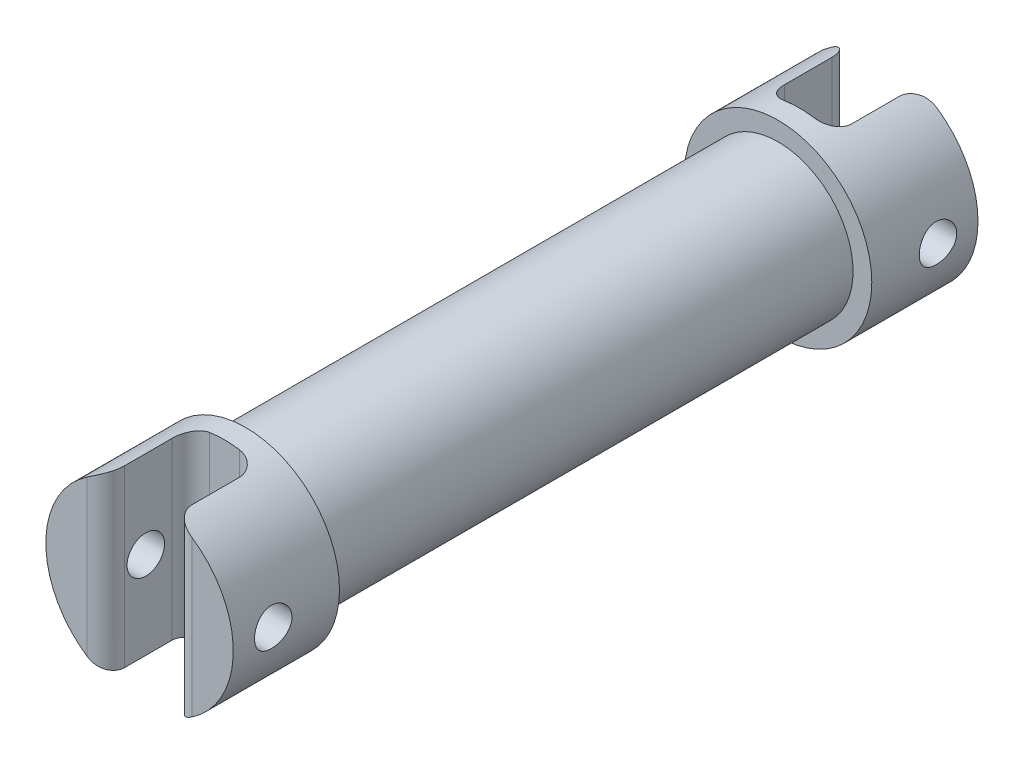
from build123d import *

# Parameters (mm, degrees)
SKETCH1_R                       = 7.5
BOSS_EXTRUDE1_DEPTH             = 8.5
CUT_EXTRUDE1_DEPTH              = 6.8
SKETCH3_R                       = 1.5
CUT_EXTRUDE2_DEPTH              = 16.249262277
FILLET1_R                       = 1.5
SKETCH5_R                       = 6
BOSS_EXTRUDE3_DEPTH             = 21.3
BOSS_EXTRUDE3_DIRECTION_2_REACH = 33.631
FILLET1_OF_MIRROR1_R            = 1.5


with BuildPart() as part:
    # Sketch1 → Boss-Extrude1 (new body)
    with BuildSketch(Plane.XY):
        Circle(SKETCH1_R)
    boss_extrude1 = extrude(amount=BOSS_EXTRUDE1_DEPTH)

    # Sketch2 → Cut-Extrude1 (cut)
    with BuildSketch(Plane.XY.offset(8.5)):
        Polygon((2.7, 0), (2.7, 13.78279584), (-2.7, 13.78279584), (-2.7, 0), (-2.7, -14.12853377), (2.7, -14.12853377), align=None)
    cut_extrude1 = extrude(amount=-CUT_EXTRUDE1_DEPTH, mode=Mode.SUBTRACT)

    # Sketch3 → Cut-Extrude2 (cut, symmetric)
    with BuildSketch(Plane(origin=(-2.7, 0, 0), x_dir=(0, 0, -1), z_dir=(1, 0, 0))):
        with Locations(Location((-5.3, 0, 0), (0, 0, 180))):
            Circle(SKETCH3_R)
    cut_extrude2 = extrude(amount=CUT_EXTRUDE2_DEPTH, both=True, mode=Mode.SUBTRACT)

    # Fillet1
    fillet1_edges = [part.edges().sort_by_distance(p)[0] for p in [
        (-2.7, 0, 1.7),
        (2.7, 0, 1.7),
        (2.7, 0, 8.5),
        (-2.7, 0, 8.5),
    ]]
    fillet(fillet1_edges, radius=FILLET1_R)

    # Sketch5 → Boss-Extrude3 (add)
    with BuildSketch(Plane(origin=(0, 0, -21.3), x_dir=(-1, 0, 0), z_dir=(0, 0, -1))):
        Circle(SKETCH5_R)
    extrude(amount=BOSS_EXTRUDE3_DEPTH)

    # Sketch5 → Boss-Extrude3 direction 2 (add, up to next)
    with BuildSketch(Plane(origin=(0, 0, -21.3), x_dir=(-1, 0, 0), z_dir=(0, 0, -1)), mode=Mode.PRIVATE) as boss_extrude3_direction_2_sk1:
        Circle(SKETCH5_R)
    boss_extrude3_direction_2_tool1 = extrude(boss_extrude3_direction_2_sk1.sketch, amount=-BOSS_EXTRUDE3_DIRECTION_2_REACH, mode=Mode.PRIVATE) - part.part
    add(boss_extrude3_direction_2_tool1.solids().sort_by_distance((0, 0, -21.3))[0])

    # Mirror1: Boss-Extrude1, Cut-Extrude1, Cut-Extrude2 across plane
    add(boss_extrude1.mirror(Plane(origin=(0, 0, -21.3), x_dir=(1, 0, 0), z_dir=(0, 0, -1))))
    add(cut_extrude1.mirror(Plane(origin=(0, 0, -21.3), x_dir=(1, 0, 0), z_dir=(0, 0, -1))), mode=Mode.SUBTRACT)
    add(cut_extrude2.mirror(Plane(origin=(0, 0, -21.3), x_dir=(1, 0, 0), z_dir=(0, 0, -1))), mode=Mode.SUBTRACT)

    # Fillet1 of Mirror1
    fillet1_of_mirror1_edges = [part.edges().sort_by_distance(p)[0] for p in [
        (-2.7, 0, -44.3),
        (2.7, 0, -44.3),
        (2.7, 0, -51.1),
        (-2.7, 0, -51.1),
    ]]
    fillet(fillet1_of_mirror1_edges, radius=FILLET1_OF_MIRROR1_R)


solid = part.part
